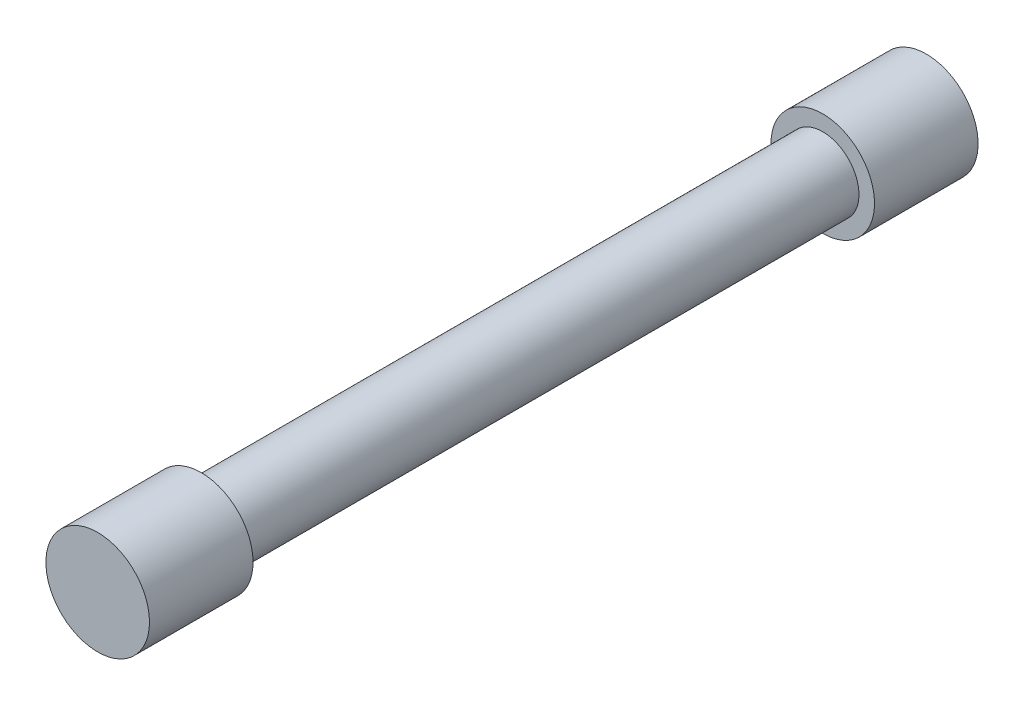
from build123d import *

# Parameters (mm, degrees)
SKETCH1_R           = 2.2225
BOSS_EXTRUDE1_DEPTH = 38.1
SKETCH2_R           = 3.175
BOSS_EXTRUDE2_DEPTH = 6.35
BOSS_EXTRUDE3_START = 6.35
SKETCH3_R           = 3.175
BOSS_EXTRUDE3_DEPTH = 6.35


with BuildPart() as part:
    # Sketch1 → Boss-Extrude1 (new body)
    with BuildSketch(Plane.XY):
        with Locations(Location((0, 0, 0), (0, 0, 180))):
            Circle(SKETCH1_R)
    extrude(amount=BOSS_EXTRUDE1_DEPTH)

    # Sketch2 → Boss-Extrude2 (add)
    with BuildSketch(Plane(origin=(0, 0, 0), x_dir=(-1, 0, 0), z_dir=(0, 0, -1))):
        Circle(SKETCH2_R)
    extrude(amount=BOSS_EXTRUDE2_DEPTH)

    # Sketch3 → Boss-Extrude3 (add)
    with BuildSketch(Plane.XY.offset(38.1).offset(BOSS_EXTRUDE3_START)):
        with Locations(Location((0, 0, 0), (0, 0, 180))):
            Circle(SKETCH3_R)
    extrude(amount=-BOSS_EXTRUDE3_DEPTH)


solid = part.part
